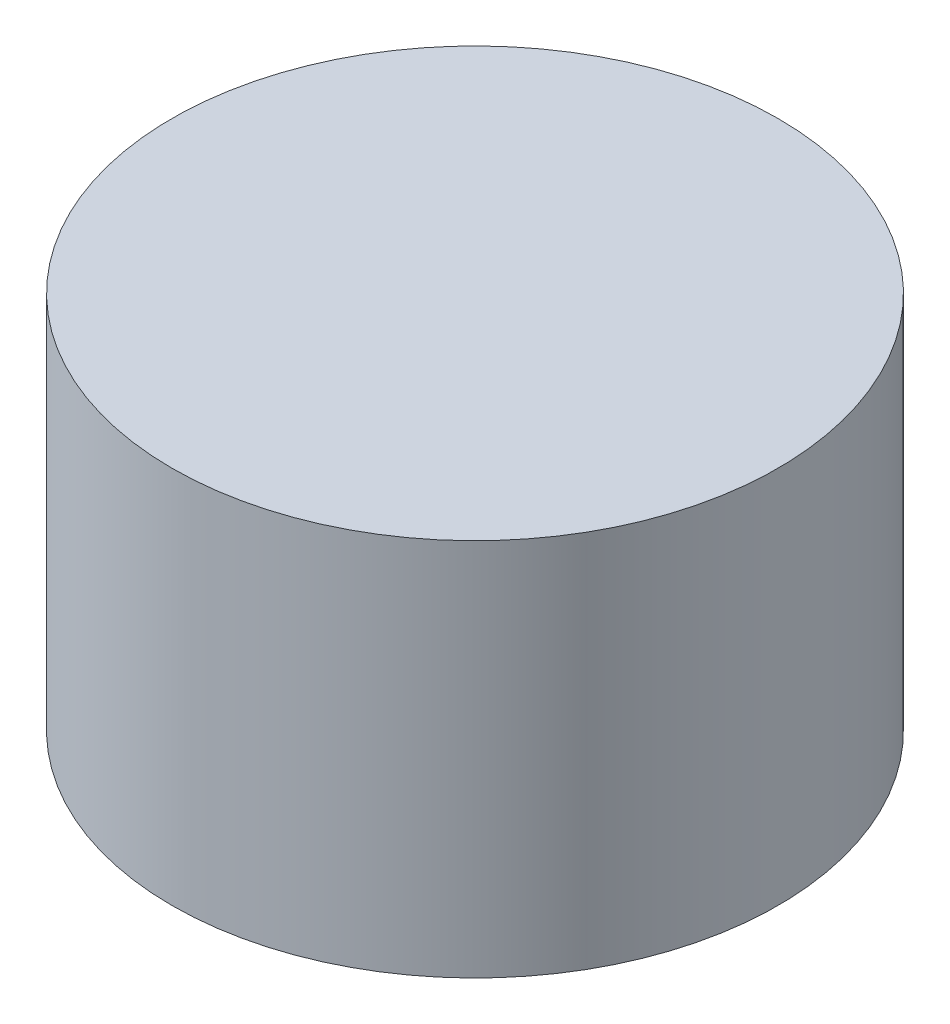
from build123d import *

# Parameters (mm, degrees)
SROUND_R     = 4
FROUND_DEPTH = 5


with BuildPart() as part:
    # SRound → FRound (new body)
    with BuildSketch(Plane(origin=(0, 0, 0), x_dir=(1, 0, 0), z_dir=(0, 1, 0))):
        Circle(SROUND_R)
    extrude(amount=-FROUND_DEPTH)


solid = part.part
